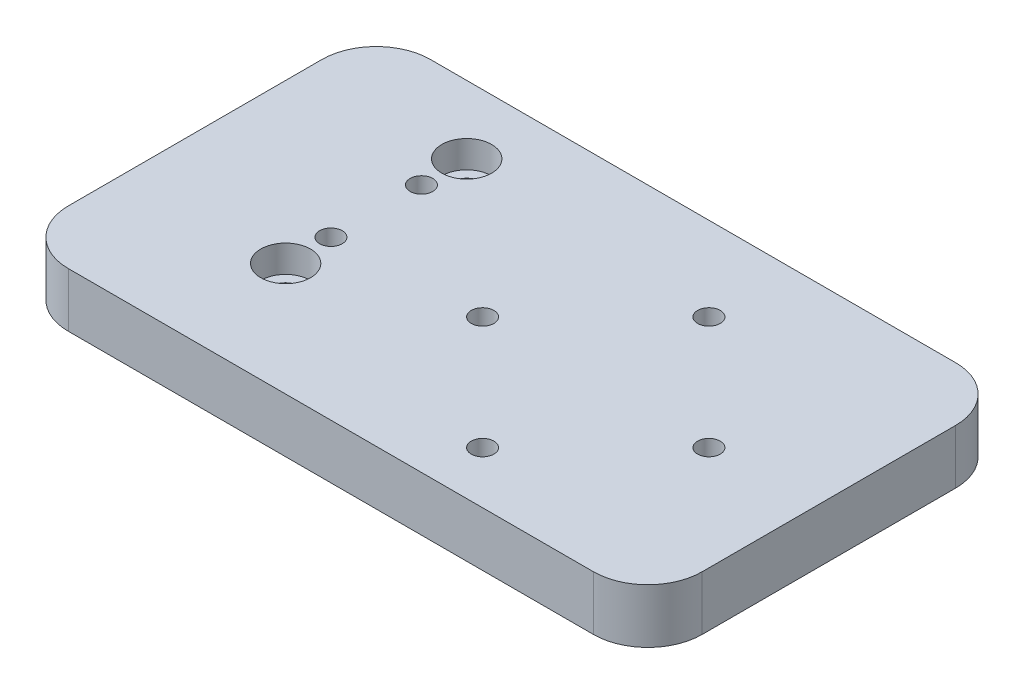
from build123d import *

# Parameters (mm, degrees)
SKETCH1_W           = 140
SKETCH1_H           = 80
SKETCH1_R           = 2.5
BOSS_EXTRUDE1_DEPTH = 12
FILLET1_R           = 12
SKETCH2_R           = 5.5
CUT_EXTRUDE1_DEPTH  = 6
SKETCH4_R           = 3.25
CUT_EXTRUDE2_DEPTH  = 6
SKETCH5_R           = 2.5
CUT_EXTRUDE3_DEPTH  = 82.510735489


with BuildPart() as part:
    # Sketch1 → Boss-Extrude1 (new body)
    with BuildSketch(Plane(origin=(0, 0, 0), x_dir=(1, 0, 0), z_dir=(0, 1, 0))):
        Rectangle(SKETCH1_W, SKETCH1_H)
        with Locations(Location((22, 21.5, 0), (0, 0, 270))):
            Circle(SKETCH1_R, mode=Mode.SUBTRACT)
        with Locations(Location((47, -3.5, 0), (0, 0, 270))):
            Circle(SKETCH1_R, mode=Mode.SUBTRACT)
        with Locations(Location((-3, -3.5, 0), (0, 0, 270))):
            Circle(SKETCH1_R, mode=Mode.SUBTRACT)
        with Locations(Location((22, -28.5, 0), (0, 0, 270))):
            Circle(SKETCH1_R, mode=Mode.SUBTRACT)
    extrude(amount=BOSS_EXTRUDE1_DEPTH)

    # Fillet1
    fillet1_edges = [part.edges().sort_by_distance(p)[0] for p in [
        (70, 6, 40),
        (-70, 6, 40),
        (-70, 6, -40),
        (70, 6, -40),
    ]]
    fillet(fillet1_edges, radius=FILLET1_R)

    # Sketch2 → Cut-Extrude1 (cut)
    with BuildSketch(Plane(origin=(0, 12, 0), x_dir=(1, 0, 0), z_dir=(0, 1, 0))):
        with Locations(Location((-35, 25, 0), (0, 0, 270))):
            Circle(SKETCH2_R)
        with Locations(Location((-35, -15, 0), (0, 0, 270))):
            Circle(SKETCH2_R)
    extrude(amount=-CUT_EXTRUDE1_DEPTH, mode=Mode.SUBTRACT)

    # Sketch4 → Cut-Extrude2 (cut)
    with BuildSketch(Plane(origin=(0, 6, 0), x_dir=(1, 0, 0), z_dir=(0, 1, 0))):
        with Locations(Location((-35, 25, 0), (0, 0, 270))):
            Circle(SKETCH4_R)
        with Locations(Location((-35, -15, 0), (0, 0, 270))):
            Circle(SKETCH4_R)
    extrude(amount=-CUT_EXTRUDE2_DEPTH, mode=Mode.SUBTRACT)

    # Sketch5 → Cut-Extrude3 (cut, through all)
    with BuildSketch(Plane(origin=(0, 12, 0), x_dir=(1, 0, 0), z_dir=(0, 1, 0))):
        with Locations(Location((-35, 15, 0), (0, 0, 270))):
            Circle(SKETCH5_R)
        with Locations(Location((-35, -5, 0), (0, 0, 270))):
            Circle(SKETCH5_R)
    extrude(amount=-CUT_EXTRUDE3_DEPTH, mode=Mode.SUBTRACT)


solid = part.part
